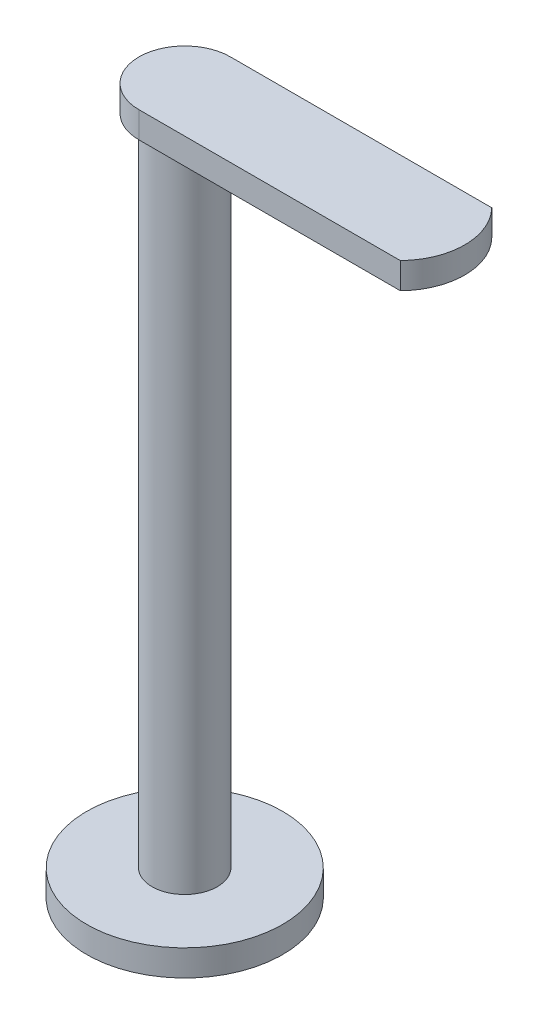
from build123d import *

# Parameters (mm, degrees)
SKETCH1_R           = 6.35
BOSS_EXTRUDE2_DEPTH = 127
SKETCH2_R           = 8.89
BOSS_EXTRUDE3_DEPTH = 5.08
BOSS_EXTRUDE5_DEPTH = 5.08
SKETCH4_R           = 19.05
BOSS_EXTRUDE6_DEPTH = 5.08


with BuildPart() as part:
    # Sketch1 → Boss-Extrude2 (new body)
    with BuildSketch(Plane(origin=(0, 0, 0), x_dir=(1, 0, 0), z_dir=(0, 1, 0))):
        with Locations(Location((0, 0, 0), (0, 0, 270))):
            Circle(SKETCH1_R)
    extrude(amount=BOSS_EXTRUDE2_DEPTH)

    # Sketch2 → Boss-Extrude3 (add)
    with BuildSketch(Plane(origin=(0, 127, 0), x_dir=(1, 0, 0), z_dir=(0, 1, 0))):
        with Locations(Location((0, 0, 0), (0, 0, 270))):
            Circle(SKETCH2_R)
    extrude(amount=BOSS_EXTRUDE3_DEPTH)

    # Sketch3 → Boss-Extrude5 (add)
    with BuildSketch(Plane(origin=(0, 132.08, 0), x_dir=(1, 0, 0), z_dir=(0, 1, 0))):
        with BuildLine():
            Line((0, 8.89), (50.8, 8.89))
            ThreePointArc((50.8, 8.89), (54.430385896, 0), (50.8, -8.89))
            Line((50.8, -8.89), (0, -8.89))
            Line((0, -8.89), (0, 8.89))
        make_face()
    extrude(amount=-BOSS_EXTRUDE5_DEPTH)

    # Sketch4 → Boss-Extrude6 (add)
    with BuildSketch(Plane.XZ):
        with Locations(Location((0, 0, 0), (0, 0, 270))):
            Circle(SKETCH4_R)
    extrude(amount=BOSS_EXTRUDE6_DEPTH)


solid = part.part
